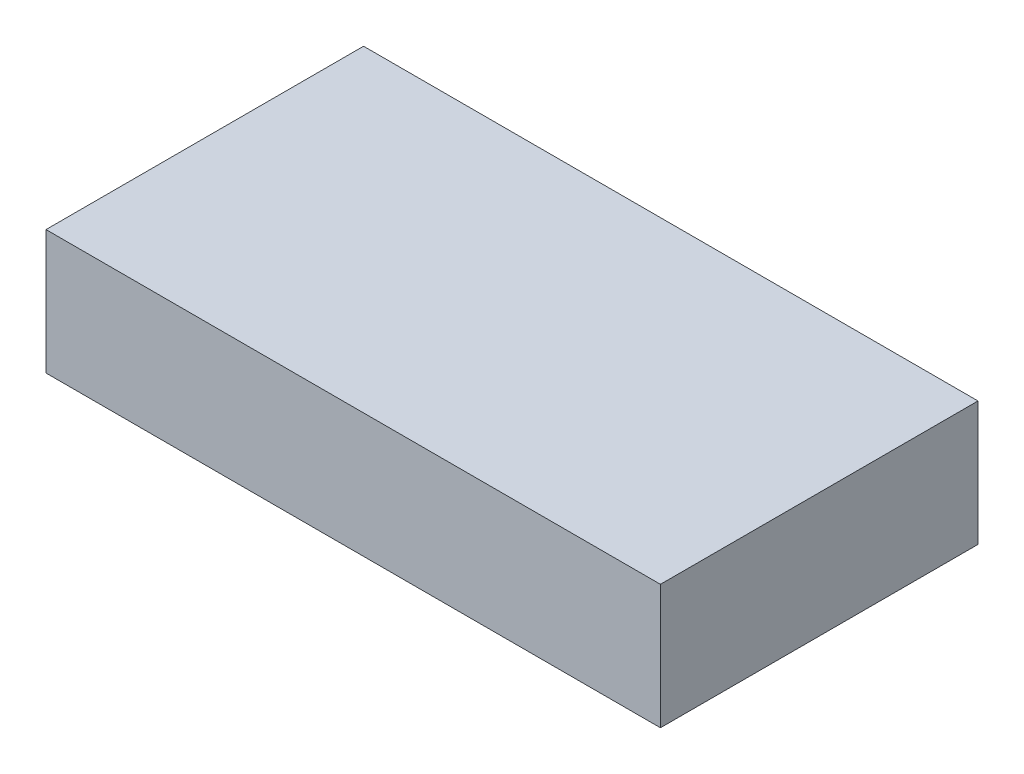
from build123d import *

# Parameters (mm, degrees)
SKETCH1_W           = 89
SKETCH1_H           = 46
BOSS_EXTRUDE1_DEPTH = 9


with BuildPart() as part:
    # Sketch1 → Boss-Extrude1 (new, symmetric)
    with BuildSketch(Plane(origin=(0, 0, 0), x_dir=(1, 0, 0), z_dir=(0, 1, 0))):
        Rectangle(SKETCH1_W, SKETCH1_H)
    extrude(amount=BOSS_EXTRUDE1_DEPTH, both=True)


solid = part.part
